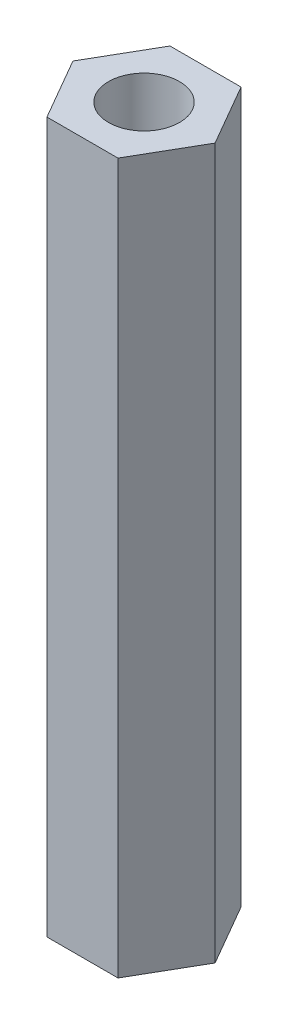
from build123d import *

# Parameters (mm, degrees)
SKETCH_1_R      = 1.5
EXTRUDE_1_DEPTH = 30


with BuildPart() as part:
    # 스케치1 → 보스-돌출1 (new body)
    with BuildSketch(Plane(origin=(0, 0, 0), x_dir=(1, 0, 0), z_dir=(0, 1, 0))):
        Polygon((1.5011107, 2.6), (-1.5011107, 2.6), (-3.0022214, 0), (-1.5011107, -2.6), (1.5011107, -2.6), (3.0022214, 0), align=None)
        with Locations(Location((0, 0, 0), (0, 0, 270))):
            Circle(SKETCH_1_R, mode=Mode.SUBTRACT)
    extrude(amount=EXTRUDE_1_DEPTH)


solid = part.part
